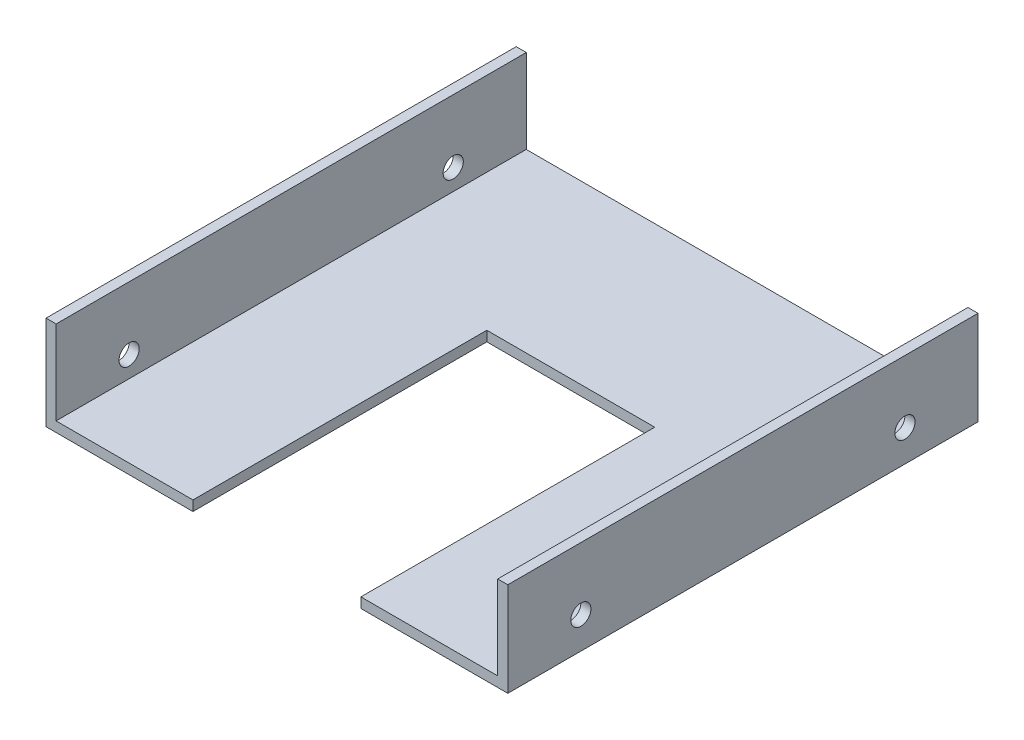
from build123d import *

# Parameters (mm, degrees)
BOSS_EXTRUDE3_DEPTH = 6
BOSS_EXTRUDE5_DEPTH = 50
BOSS_EXTRUDE6_DEPTH = 50
SKETCH4_R           = 6
CUT_EXTRUDE1_DEPTH  = 6
SKETCH5_R           = 6
CUT_EXTRUDE2_DEPTH  = 6


with BuildPart() as part:
    # Sketch1 → Boss-Extrude3 (new body)
    with BuildSketch(Plane(origin=(0, 0, 0), x_dir=(1, 0, 0), z_dir=(0, 1, 0))):
        Polygon((-8.017197152, -238.130630631), (-8.017197152, -204.926643474), (-8.017197152, -63.130630631), (91.982802848, -63.130630631), (91.982802848, -238.130630631), (179.482802848, -238.130630631), (179.482802848, 41.869369369), (-95.517197152, 41.869369369), (-95.517197152, -238.130630631), align=None)
    extrude(amount=BOSS_EXTRUDE3_DEPTH)

    # Sketch2 → Boss-Extrude5 (add)
    with BuildSketch(Plane(origin=(0, 6, 0), x_dir=(1, 0, 0), z_dir=(0, 1, 0))):
        Polygon((-89.517197152, -17.106233318), (-89.517197152, -238.130630631), (-95.517197152, -238.130630631), (-95.517197152, 41.869369369), (-89.517197152, 41.869369369), align=None)
    extrude(amount=BOSS_EXTRUDE5_DEPTH)

    # Sketch3 → Boss-Extrude6 (add)
    with BuildSketch(Plane(origin=(0, 6, 0), x_dir=(1, 0, 0), z_dir=(0, 1, 0))):
        Polygon((173.482802848, -39.36353764), (173.482802848, -238.130630631), (179.482802848, -238.130630631), (179.482802848, 41.869369369), (173.482802848, 41.869369369), align=None)
    extrude(amount=BOSS_EXTRUDE6_DEPTH)

    # Sketch4 → Cut-Extrude1 (cut)
    with BuildSketch(Plane(origin=(179.482802848, 0, 0), x_dir=(0, 0, -1), z_dir=(1, 0, 0))):
        with Locations((-194.630630631, 18.828241407)):
            Circle(SKETCH4_R)
        with Locations((-1.630630631, 18.828241407)):
            Circle(SKETCH4_R)
    extrude(amount=-CUT_EXTRUDE1_DEPTH, mode=Mode.SUBTRACT)

    # Sketch5 → Cut-Extrude2 (cut)
    with BuildSketch(Plane.ZY.offset(95.517197152)):
        with Locations((1.630630631, 18.5)):
            Circle(SKETCH5_R)
        with Locations((194.630630631, 18.5)):
            Circle(SKETCH5_R)
    extrude(amount=-CUT_EXTRUDE2_DEPTH, mode=Mode.SUBTRACT)


solid = part.part
